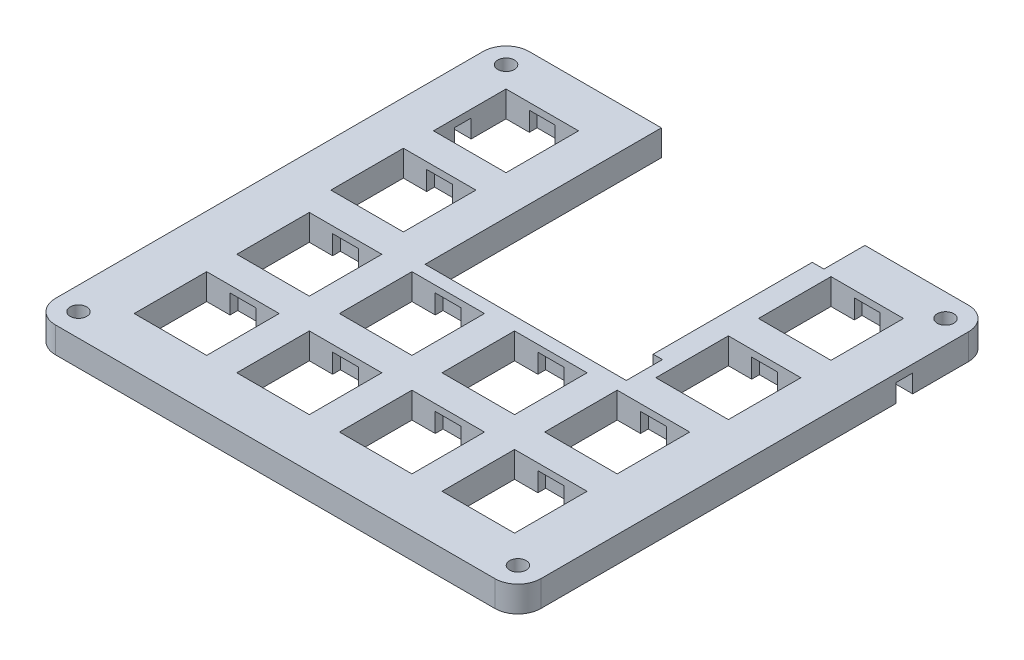
from build123d import *

# Parameters (mm, degrees)
SKETCH2_R           = 1.6
BOSS_EXTRUDE1_DEPTH = 5
CUT_EXTRUDE1_DEPTH  = 3.5
SKETCH4_W           = 2.5
SKETCH4_H           = 1.5
CUT_EXTRUDE2_DEPTH  = 3.7


with BuildPart() as part:
    # Sketch2 → Boss-Extrude1 (new body)
    with BuildSketch(Plane(origin=(0, 0, 0), x_dir=(1, 0, 0), z_dir=(0, 1, 0))):
        with BuildLine():
            Line((-46.858540632, -41.275), (-46.858540632, 41.275))
            ThreePointArc((-46.858540632, 41.275), (-45.557936393, 44.414936393), (-42.418, 45.715540632))
            Line((-42.418, 45.715540632), (-16.875382857, 45.715540632))
            Line((-16.875382857, 45.715540632), (-16.875382857, 30.218907102))
            Line((-16.875382857, 30.218907102), (-16.875382857, 0.094907102))
            Line((-16.875382857, 0.094907102), (-9.912382857, 0.094907102))
            Line((-9.912382857, 0.094907102), (21.96872062, 0.094907102))
            Line((21.96872062, 0.094907102), (21.96872062, 7.075))
            Line((21.96872062, 7.075), (20.16872062, 7.075))
            Line((20.16872062, 7.075), (20.16872062, 9.575))
            Line((20.16872062, 9.575), (20.16872062, 37.797317828))
            Line((20.16872062, 37.797317828), (22.418, 37.797317828))
            Line((22.418, 37.797317828), (22.418, 39.575))
            Line((22.418, 39.575), (22.418, 41.275))
            Line((22.418, 41.275), (22.418, 45.715540632))
            Line((22.418, 45.715540632), (42.418, 45.715540632))
            ThreePointArc((42.418, 45.715540632), (45.557936393, 44.414936393), (46.858540632, 41.275))
            Line((46.858540632, 41.275), (46.858540632, -41.275))
            ThreePointArc((46.858540632, -41.275), (45.557936393, -44.414936393), (42.418, -45.715540632))
            Line((42.418, -45.715540632), (-42.418, -45.715540632))
            ThreePointArc((-42.418, -45.715540632), (-45.557936393, -44.414936393), (-46.858540632, -41.275))
        make_face()
        with Locations(Location((42.418, 41.275, 0), (0, 0, 270))):
            Circle(SKETCH2_R, mode=Mode.SUBTRACT)
        with Locations(Location((-42.418, 41.275, 0), (0, 0, 270))):
            Circle(SKETCH2_R, mode=Mode.SUBTRACT)
        with Locations(Location((-42.418, -41.275, 0), (0, 0, 270))):
            Circle(SKETCH2_R, mode=Mode.SUBTRACT)
        with Locations(Location((42.418, -41.275, 0), (0, 0, 270))):
            Circle(SKETCH2_R, mode=Mode.SUBTRACT)
        Polygon((-31.375382857, 37.218907102), (-38.375382857, 37.218907102), (-38.375382857, 23.218907102), (-24.375382857, 23.218907102), (-24.375382857, 37.218907102), align=None, mode=Mode.SUBTRACT)
        Polygon((-38.375382857, 10.406907102), (-38.375382857, 17.406907102), (-24.375382857, 17.406907102), (-24.375382857, 3.406907102), (-38.375382857, 3.406907102), align=None, mode=Mode.SUBTRACT)
        Polygon((-36.724382857, -9.405092898), (-36.724382857, -2.405092898), (-22.724382857, -2.405092898), (-22.724382857, -16.405092898), (-36.724382857, -16.405092898), align=None, mode=Mode.SUBTRACT)
        Polygon((-36.724382857, -29.217092898), (-36.724382857, -22.217092898), (-22.724382857, -22.217092898), (-22.724382857, -36.217092898), (-36.724382857, -36.217092898), align=None, mode=Mode.SUBTRACT)
        Polygon((-9.912382857, -22.217092898), (-2.912382857, -22.217092898), (-2.912382857, -36.217092898), (-16.912382857, -36.217092898), (-16.912382857, -22.217092898), align=None, mode=Mode.SUBTRACT)
        Polygon((-9.912382857, -16.405092898), (-2.912382857, -16.405092898), (-2.912382857, -2.405092898), (-16.912382857, -2.405092898), (-16.912382857, -16.405092898), align=None, mode=Mode.SUBTRACT)
        Polygon((9.899617143, -2.405092898), (2.899617143, -2.405092898), (2.899617143, -16.405092898), (16.899617143, -16.405092898), (16.899617143, -2.405092898), align=None, mode=Mode.SUBTRACT)
        Polygon((9.899617143, -22.217092898), (2.899617143, -22.217092898), (2.899617143, -36.217092898), (16.899617143, -36.217092898), (16.899617143, -22.217092898), align=None, mode=Mode.SUBTRACT)
        Polygon((36.711617143, -29.217092898), (36.711617143, -22.217092898), (22.711617143, -22.217092898), (22.711617143, -36.217092898), (36.711617143, -36.217092898), align=None, mode=Mode.SUBTRACT)
        Polygon((29.711617143, -2.405092898), (22.711617143, -2.405092898), (22.711617143, -16.405092898), (36.711617143, -16.405092898), (36.711617143, -2.405092898), align=None, mode=Mode.SUBTRACT)
        Polygon((38.362617143, 10.406907102), (38.362617143, 17.406907102), (24.362617143, 17.406907102), (24.362617143, 3.406907102), (38.362617143, 3.406907102), align=None, mode=Mode.SUBTRACT)
        Polygon((38.362617143, 30.218907102), (38.362617143, 23.218907102), (24.362617143, 23.218907102), (24.362617143, 37.218907102), (38.362617143, 37.218907102), align=None, mode=Mode.SUBTRACT)
    extrude(amount=BOSS_EXTRUDE1_DEPTH)

    # Sketch3 → Cut-Extrude1 (cut)
    with BuildSketch(Plane.XZ):
        Polygon((38.362617143, -30.492), (42.418, -30.492), (46.218, -30.492), (46.858540632, -30.492), (46.858540632, -27.292), (46.218, -27.292), (38.362617143, -27.292), align=None)
        Polygon((-46.218, -27.292), (-46.858540632, -27.292), (-46.858540632, -30.492), (-46.218, -30.492), (-42.418, -30.492), (-38.375382857, -30.492), (-38.375382857, -27.292), align=None)
    extrude(amount=-CUT_EXTRUDE1_DEPTH, mode=Mode.SUBTRACT)

    # Sketch4 → Cut-Extrude2 (cut)
    with BuildSketch(Plane.XZ):
        with Locations((32.612617143, -37.968907102)):
            Rectangle(SKETCH4_W, SKETCH4_H)
        with Locations((30.112617143, -37.968907102)):
            Rectangle(SKETCH4_W, SKETCH4_H)
        with Locations((32.612617143, -22.468907102)):
            Rectangle(SKETCH4_W, SKETCH4_H)
        with Locations((30.112617143, -22.468907102)):
            Rectangle(SKETCH4_W, SKETCH4_H)
        with Locations((32.612617143, -2.656907102)):
            Rectangle(SKETCH4_W, SKETCH4_H)
        with Locations((30.112617143, -18.156907102)):
            Rectangle(SKETCH4_W, SKETCH4_H)
        with Locations((32.612617143, -18.156907102)):
            Rectangle(SKETCH4_W, SKETCH4_H)
        with Locations((30.112617143, -2.656907102)):
            Rectangle(SKETCH4_W, SKETCH4_H)
        with Locations((30.961617143, 1.655092898)):
            Rectangle(SKETCH4_W, SKETCH4_H)
        with Locations((28.461617143, 1.655092898)):
            Rectangle(SKETCH4_W, SKETCH4_H)
        with Locations((30.961617143, 17.155092898)):
            Rectangle(SKETCH4_W, SKETCH4_H)
        with Locations((28.461617143, 17.155092898)):
            Rectangle(SKETCH4_W, SKETCH4_H)
        with Locations((30.961617143, 21.467092898)):
            Rectangle(SKETCH4_W, SKETCH4_H)
        with Locations((28.461617143, 21.467092898)):
            Rectangle(SKETCH4_W, SKETCH4_H)
        with Locations((30.961617143, 36.967092898)):
            Rectangle(SKETCH4_W, SKETCH4_H)
        with Locations((28.461617143, 36.967092898)):
            Rectangle(SKETCH4_W, SKETCH4_H)
        with Locations((11.149617143, 36.967092898)):
            Rectangle(SKETCH4_W, SKETCH4_H)
        with Locations((8.649617143, 36.967092898)):
            Rectangle(SKETCH4_W, SKETCH4_H)
        with Locations((8.649617143, 21.467092898)):
            Rectangle(SKETCH4_W, SKETCH4_H)
        with Locations((11.149617143, 21.467092898)):
            Rectangle(SKETCH4_W, SKETCH4_H)
        with Locations((11.149617143, 17.155092898)):
            Rectangle(SKETCH4_W, SKETCH4_H)
        with Locations((8.649617143, 17.155092898)):
            Rectangle(SKETCH4_W, SKETCH4_H)
        with Locations((11.149617143, 1.655092898)):
            Rectangle(SKETCH4_W, SKETCH4_H)
        with Locations((8.649617143, 1.655092898)):
            Rectangle(SKETCH4_W, SKETCH4_H)
        with Locations((-8.662382857, 1.655092898)):
            Rectangle(SKETCH4_W, SKETCH4_H)
        with Locations((-11.162382857, 1.655092898)):
            Rectangle(SKETCH4_W, SKETCH4_H)
        with Locations((-8.662382857, 17.155092898)):
            Rectangle(SKETCH4_W, SKETCH4_H)
        with Locations((-11.162382857, 17.155092898)):
            Rectangle(SKETCH4_W, SKETCH4_H)
        with Locations((-8.662382857, 21.467092898)):
            Rectangle(SKETCH4_W, SKETCH4_H)
        with Locations((-11.162382857, 21.467092898)):
            Rectangle(SKETCH4_W, SKETCH4_H)
        with Locations((-8.662382857, 36.967092898)):
            Rectangle(SKETCH4_W, SKETCH4_H)
        with Locations((-11.162382857, 36.967092898)):
            Rectangle(SKETCH4_W, SKETCH4_H)
        with Locations((-28.474382857, 17.155092898)):
            Rectangle(SKETCH4_W, SKETCH4_H)
        with Locations((-30.974382857, 17.155092898)):
            Rectangle(SKETCH4_W, SKETCH4_H)
        with Locations((-30.974382857, 21.467092898)):
            Rectangle(SKETCH4_W, SKETCH4_H)
        with Locations((-28.474382857, 21.467092898)):
            Rectangle(SKETCH4_W, SKETCH4_H)
        with Locations((-28.474382857, 36.967092898)):
            Rectangle(SKETCH4_W, SKETCH4_H)
        with Locations((-30.974382857, 36.967092898)):
            Rectangle(SKETCH4_W, SKETCH4_H)
        with Locations((-28.474382857, 1.655092898)):
            Rectangle(SKETCH4_W, SKETCH4_H)
        with Locations((-30.974382857, 1.655092898)):
            Rectangle(SKETCH4_W, SKETCH4_H)
        Polygon((-33.875382857, -1.906907102), (-33.875382857, -3.406907102), (-31.375382857, -3.406907102), (-28.875382857, -3.406907102), (-28.875382857, -1.906907102), align=None)
        with Locations((-32.625382857, -18.156907102)):
            Rectangle(SKETCH4_W, SKETCH4_H)
        with Locations((-30.125382857, -18.156907102)):
            Rectangle(SKETCH4_W, SKETCH4_H)
        with Locations((-32.625382857, -22.468907102)):
            Rectangle(SKETCH4_W, SKETCH4_H)
        with Locations((-30.125382857, -22.468907102)):
            Rectangle(SKETCH4_W, SKETCH4_H)
        with Locations((-30.125382857, -37.968907102)):
            Rectangle(SKETCH4_W, SKETCH4_H)
        with Locations((-32.625382857, -37.968907102)):
            Rectangle(SKETCH4_W, SKETCH4_H)
    extrude(amount=-CUT_EXTRUDE2_DEPTH, mode=Mode.SUBTRACT)


solid = part.part
